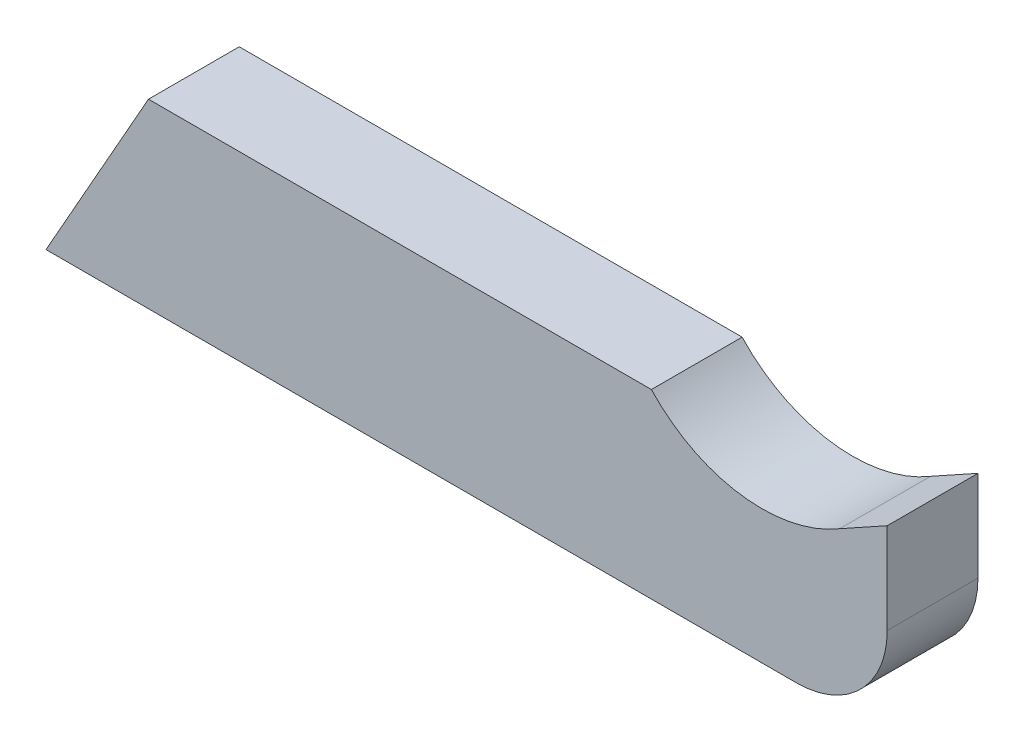
from build123d import *

# Parameters (mm, degrees)
BOSS_EXTRUDE1_DEPTH = 3


with BuildPart() as part:
    # Sketch1 → Boss-Extrude1 (new body)
    with BuildSketch(Plane(origin=(0, 0, 0), x_dir=(0, 1, 0), z_dir=(0, 0, 1))):
        with BuildLine():
            Line((-2.122941602, 14.254932242), (-2.122941602, -10.553285524))
            ThreePointArc((-2.122941602, -10.553285524), (-1.244261946, -12.674605867), (0.877058398, -13.553285524))
            Line((0.877058398, -13.553285524), (3.877058398, -13.553285524))
            Line((3.877058398, -13.553285524), (3.006420494, -11.983925105))
            ThreePointArc((3.006420494, -11.983925105), (2.340422166, -8.716396804), (3.877058398, -5.756828581))
            Line((3.877058398, -5.756828581), (3.877058398, 10.86753602))
            Line((3.877058398, 10.86753602), (-2.122941602, 14.254932242))
        make_face()
    extrude(amount=BOSS_EXTRUDE1_DEPTH)


solid = part.part
